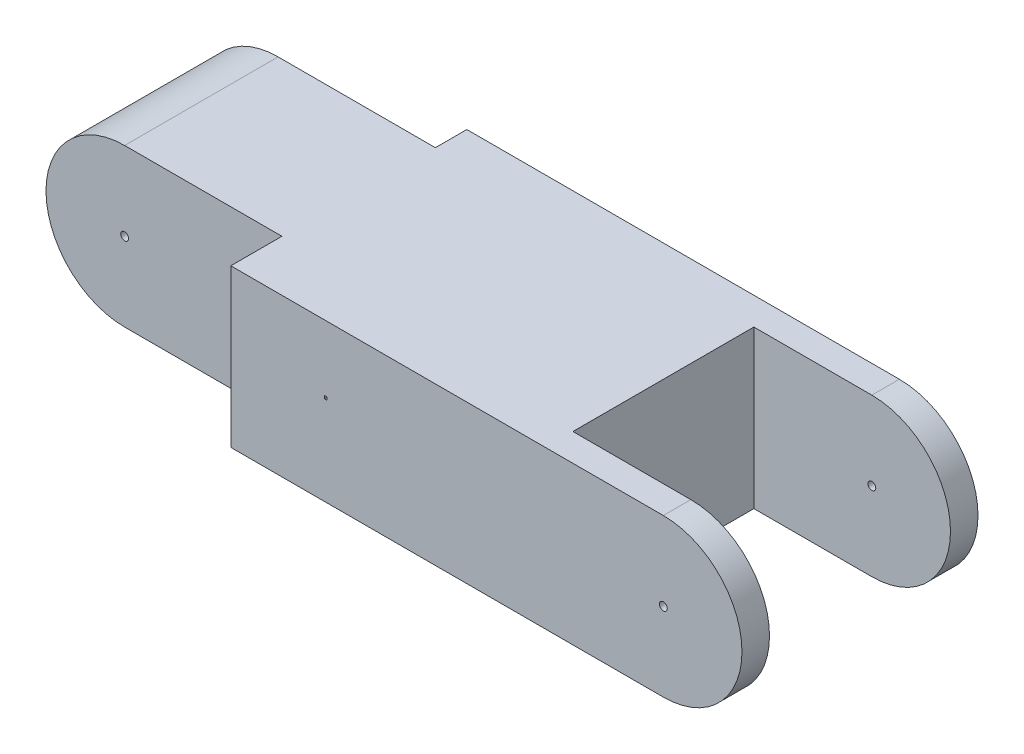
from build123d import *

# Parameters (mm, degrees)
BOSS_EXTRU_3_DEPTH      = 40
BOSS_EXTRU_3_DEPTH_BACK = 20.027256934
ESQUISSE12_W            = 60
ESQUISSE12_H            = 8
ENL_V_MAT_EXTRU_1_DEPTH = 40
ESQUISSE12_3_W          = 60
ESQUISSE12_3_H          = 13
ENL_V_MAT_EXTRU_2_DEPTH = 40
ESQUISSE20_W            = 0.599721203
ESQUISSE20_H            = 0.763281531
ENL_V_MAT_EXTRU_4_DEPTH = 6
ESQUISSE22_W            = 44
ESQUISSE22_H            = 20
ENL_V_MAT_EXTRU_6_DEPTH = 28
ESQUISSE24_W            = 50
ESQUISSE24_H            = 46.027256934
ENL_V_MAT_EXTRU_7_DEPTH = 153
ESQUISSE25_R            = 1
ENL_V_MAT_EXTRU_8_DEPTH = 153
ESQUISSE26_R            = 1
ENL_V_MAT_EXTRU_9_DEPTH = 72


with BuildPart() as part:
    # Esquisse5 → Boss.-Extru.3 (new, two sides: drawn at the far end of the back side and taken through both)
    with BuildSketch(Plane.XY.offset(-BOSS_EXTRU_3_DEPTH_BACK)):
        with BuildLine():
            Line((0, 0), (-150, 0))
            ThreePointArc((-150, 0), (-170, 20), (-150, 40))
            Line((-150, 40), (0, 40))
            ThreePointArc((0, 40), (20, 20), (0, 0))
        make_face()
    extrude(amount=BOSS_EXTRU_3_DEPTH + BOSS_EXTRU_3_DEPTH_BACK)

    # Esquisse12 → Enlèv. mat.-Extru.1 (cut)
    with BuildSketch(Plane(origin=(0, 40, 0), x_dir=(1, 0, 0), z_dir=(0, 1, 0))):
        with Locations((-140, 16.027256934)):
            Rectangle(ESQUISSE12_W, ESQUISSE12_H)
    extrude(amount=-ENL_V_MAT_EXTRU_1_DEPTH, mode=Mode.SUBTRACT)

    # Esquisse12<3> → Enlèv. mat.-Extru.2 (cut)
    with BuildSketch(Plane(origin=(0, 40, 0), x_dir=(1, 0, 0), z_dir=(0, 1, 0))):
        with Locations((-140, -33.5)):
            Rectangle(ESQUISSE12_3_W, ESQUISSE12_3_H)
    extrude(amount=-ENL_V_MAT_EXTRU_2_DEPTH, mode=Mode.SUBTRACT)

    # Esquisse20 → Enlèv. mat.-Extru.4 (cut)
    with BuildSketch(Plane.XY.offset(40)):
        with Locations((-85.88772133, 22.969257081)):
            Rectangle(ESQUISSE20_W, ESQUISSE20_H)
    extrude(amount=-ENL_V_MAT_EXTRU_4_DEPTH, mode=Mode.SUBTRACT)

    # Esquisse22 → Enlèv. mat.-Extru.6 (cut)
    with BuildSketch(Plane(origin=(0, 0, -12.027256934), x_dir=(-1, 0, 0), z_dir=(0, 0, -1))):
        with Locations((142, 20)):
            Rectangle(ESQUISSE22_W, ESQUISSE22_H)
    extrude(amount=-ENL_V_MAT_EXTRU_6_DEPTH, mode=Mode.SUBTRACT)

    # Esquisse24 → Enlèv. mat.-Extru.7 (cut)
    with BuildSketch(Plane(origin=(0, 40, 0), x_dir=(1, 0, 0), z_dir=(0, 1, 0))):
        with Locations((-5, -9.986371533)):
            Rectangle(ESQUISSE24_W, ESQUISSE24_H)
    extrude(amount=-ENL_V_MAT_EXTRU_7_DEPTH, mode=Mode.SUBTRACT)

    # Esquisse25 → Enlèv. mat.-Extru.8 (cut)
    with BuildSketch(Plane.XY.offset(40)):
        with Locations((0, 20)):
            Circle(ESQUISSE25_R)
    extrude(amount=-ENL_V_MAT_EXTRU_8_DEPTH, mode=Mode.SUBTRACT)

    # Esquisse26 → Enlèv. mat.-Extru.9 (cut)
    with BuildSketch(Plane.XY.offset(27)):
        with Locations((-150, 20)):
            Circle(ESQUISSE26_R)
    extrude(amount=-ENL_V_MAT_EXTRU_9_DEPTH, mode=Mode.SUBTRACT)


solid = part.part
